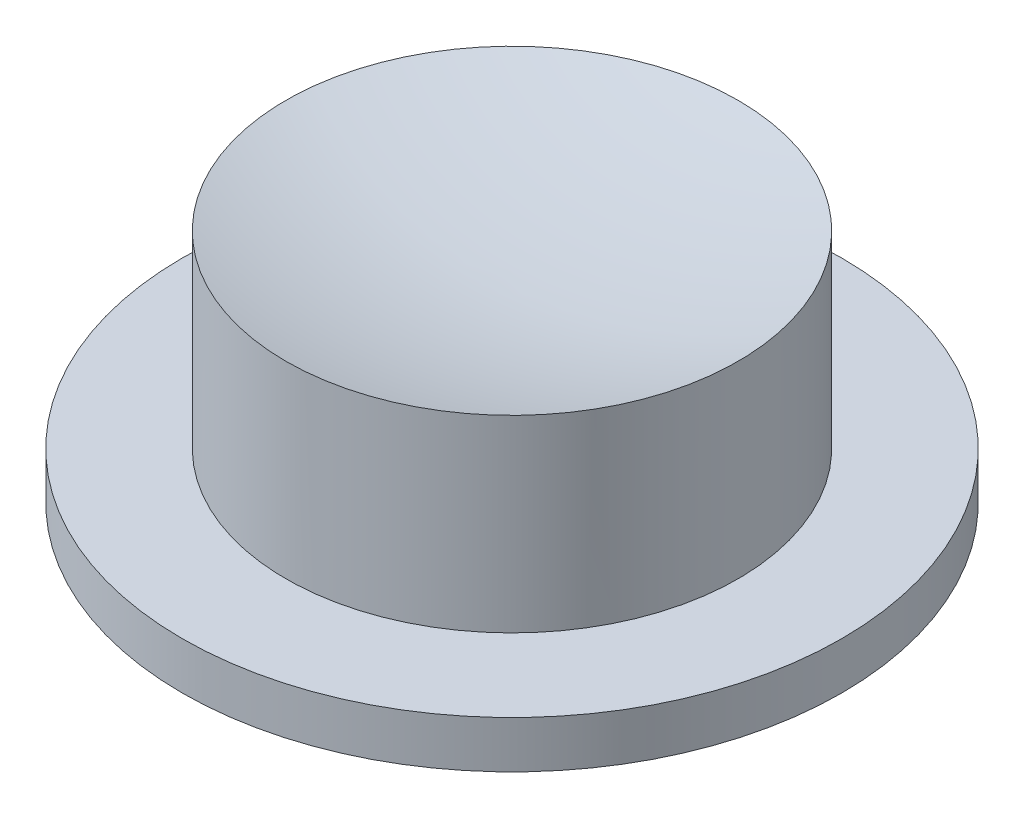
from build123d import *

# Parameters (mm, degrees)
SKETCH_1_R      = 2.4
EXTRUDE_1_DEPTH = 2.5
SKETCH_3_R      = 3.5
EXTRUDE_2_DEPTH = 0.5


with BuildPart() as part:
    # Эскиз1 → Бобышка-Вытянуть1 (new body)
    with BuildSketch(Plane(origin=(0, 0, 0), x_dir=(1, 0, 0), z_dir=(0, 1, 0))):
        with Locations(Location((0, 0, 0), (0, 0, 270))):
            Circle(SKETCH_1_R)
    extrude(amount=EXTRUDE_1_DEPTH)

    # Эскиз2 → Вырез-Повернуть1 (revolve, cut)
    with BuildSketch(Plane(origin=(0, 0, 0), x_dir=(0, 0, -1), z_dir=(1, 0, 0))):
        with BuildLine():
            Line((0, 2.5), (0, 2.149039298))
            ThreePointArc((0, 2.149039298), (1.212762695, 2.237243589), (2.4, 2.5))
            Line((2.4, 2.5), (0, 2.5))
        make_face()
    revolve(axis=Axis((0, 2.5, 0), (0, 1, 0)), mode=Mode.SUBTRACT)

    # Эскиз3 → Бобышка-Вытянуть2 (add)
    with BuildSketch(Plane.XZ):
        with Locations(Location((0, 0, 0), (0, 0, 270))):
            Circle(SKETCH_3_R)
    extrude(amount=-EXTRUDE_2_DEPTH)


solid = part.part
